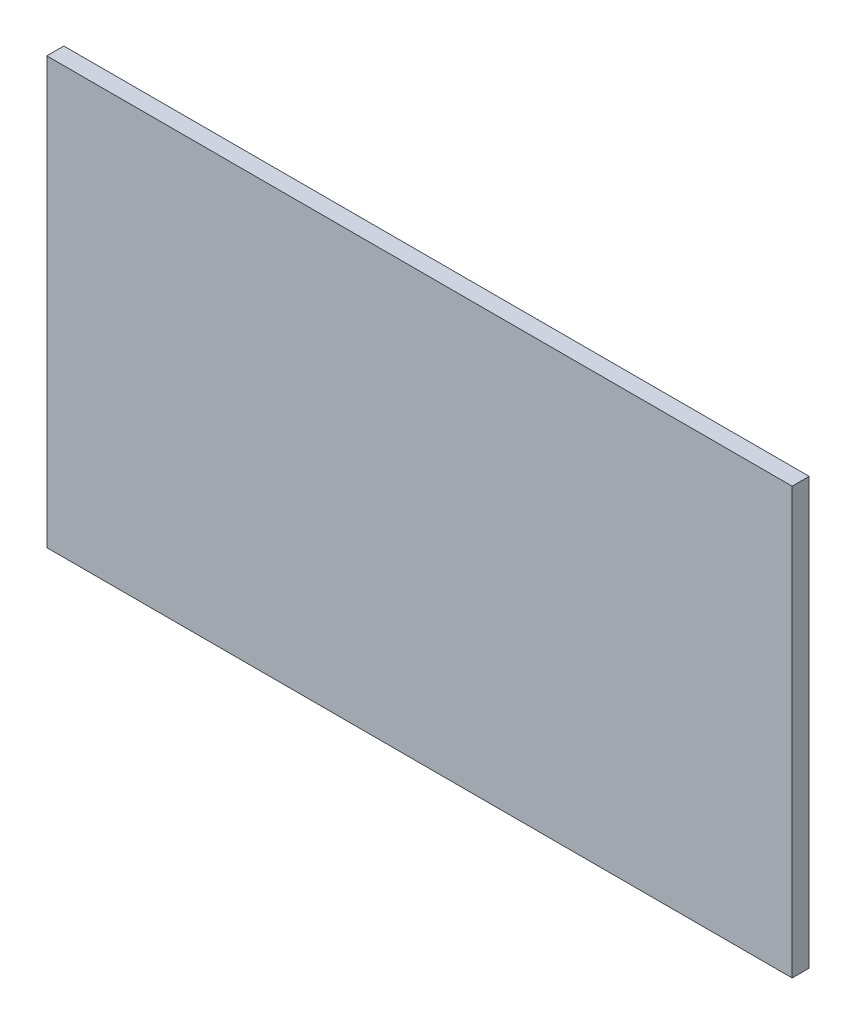
from build123d import *

# Parameters (mm, degrees)
SKETCH_1_W                          = 70
SKETCH_1_H                          = 40
F_70X40_CAMERA_BOARD_VERTICAL_DEPTH = 1.6


with BuildPart() as part:
    # 草图1 → 70x40_camera_board_vertical (new body)
    with BuildSketch(Plane.XY):
        with Locations((0, 58)):
            Rectangle(SKETCH_1_W, SKETCH_1_H)
    extrude(amount=F_70X40_CAMERA_BOARD_VERTICAL_DEPTH)


solid = part.part
